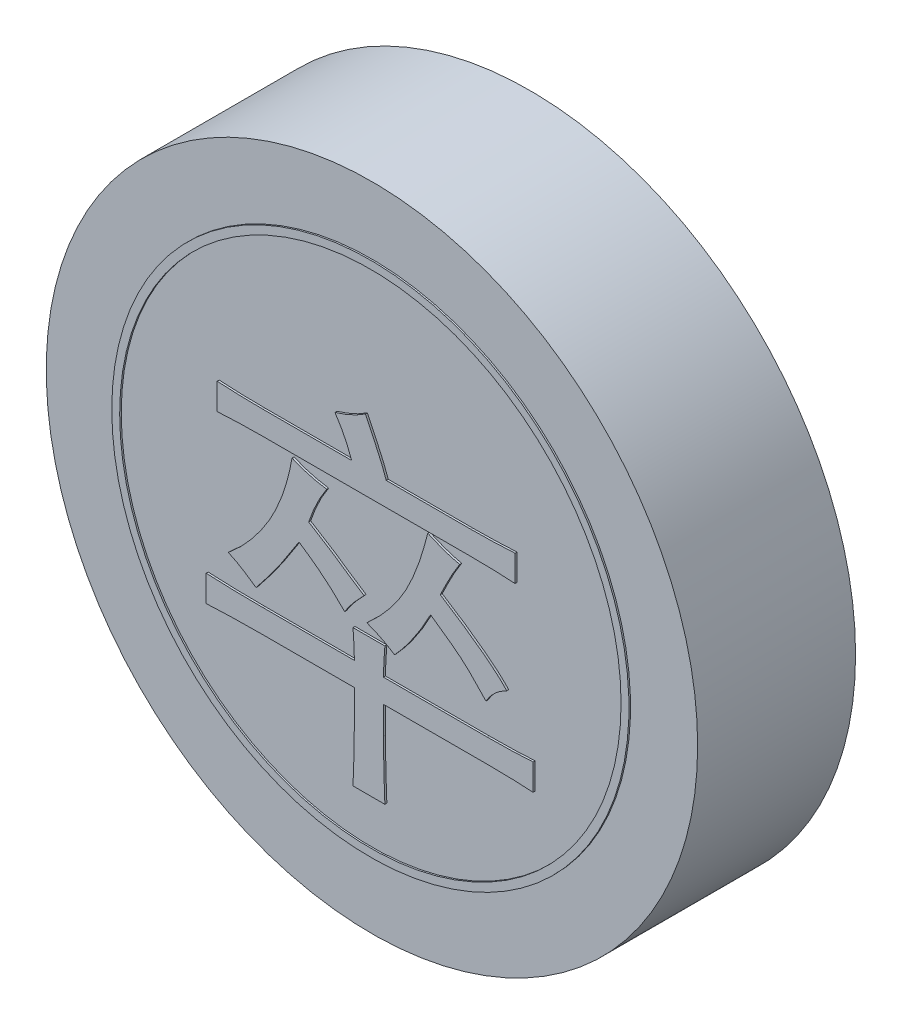
from build123d import *

# Parameters (mm, degrees)
SKETCH_1_R               = 16.5
DIAMETER33_HEIGHT8_DEPTH = 8
CHARACTER_DEPTH          = 0.1
SKETCH_3_R               = 13.1
SKETCH_3_R_2             = 12.7
INK_RING_DEPTH           = 0.08


with BuildPart() as part:
    # 草图1 → Diameter33_Height8 (new body)
    with BuildSketch(Plane.XY):
        Circle(SKETCH_1_R)
    extrude(amount=-DIAMETER33_HEIGHT8_DEPTH)

    # 草图2 → Character_卒 (add)
    with BuildSketch(Plane.XY):
        with BuildLine():
            add(Edge.make_bspline(
                [(-0.789473684, -4.850877193), (-0.790801429, -4.759897806), (-0.793710801, -4.56054267), (-0.807970927, -4.235644823), (-0.827994939, -3.858637974), (-0.848649707, -3.590279221), (-0.859649123, -3.447368421)],
                knots=[0, 0, 0, 0, 0.776803547, 1.702141345, 2.77630666, 4, 4, 4, 4], degree=3))
            Line((-0.859649123, -3.447368421), (0.754385965, -3.447368421))
            add(Edge.make_bspline(
                [(0.754385965, -3.447368421), (0.743322045, -3.581608953), (0.722136363, -3.838658655), (0.702337175, -4.207039208), (0.688146654, -4.540612928), (0.685474648, -4.751233078), (0.684210526, -4.850877193)],
                knots=[0, 0, 0, 0, 1.149871826, 2.201825379, 3.14928596, 4, 4, 4, 4], degree=3))
            Line((0.684210526, -4.850877193), (5.947368421, -4.850877193))
            add(Edge.make_bspline(
                [(5.947368421, -4.850877193), (6.153571591, -4.849759117), (6.557354449, -4.847569722), (7.149120938, -4.833995367), (7.715061172, -4.814883935), (8.082995961, -4.791937596), (8.263157895, -4.780701754)],
                knots=[0, 0, 0, 0, 1.067833177, 2.091009239, 3.065248851, 4, 4, 4, 4], degree=3))
            Line((8.263157895, -4.780701754), (8.263157895, -6.114035088))
            add(Edge.make_bspline(
                [(8.263157895, -6.114035088), (8.084728409, -6.102816563), (7.722852753, -6.080064096), (7.169915527, -6.060827798), (6.599807697, -6.04723991), (6.213350691, -6.044996382), (6.01754386, -6.043859649)],
                knots=[0, 0, 0, 0, 0.954695298, 1.936232608, 2.954347453, 4, 4, 4, 4], degree=3))
            Line((6.01754386, -6.043859649), (0.684210526, -6.043859649))
            Line((0.684210526, -6.043859649), (0.684210526, -7.447368421))
            add(Edge.make_bspline(
                [(0.684210526, -7.447368421), (0.685397037, -7.683891967), (0.687800644, -8.163035928), (0.701667727, -8.890804431), (0.721199551, -9.636859607), (0.743233706, -10.140053014), (0.754385965, -10.394736842)],
                knots=[0, 0, 0, 0, 0.962642255, 1.950098551, 2.962472993, 4, 4, 4, 4], degree=3))
            Line((0.754385965, -10.394736842), (-0.859649123, -10.394736842))
            add(Edge.make_bspline(
                [(-0.859649123, -10.394736842), (-0.848496864, -10.140053014), (-0.826462709, -9.636859607), (-0.806930884, -8.890804431), (-0.793063802, -8.163035928), (-0.790660195, -7.683891967), (-0.789473684, -7.447368421)],
                knots=[0, 0, 0, 0, 1.037527007, 2.049901449, 3.037357745, 4, 4, 4, 4], degree=3))
            Line((-0.789473684, -7.447368421), (-0.789473684, -6.043859649))
            Line((-0.789473684, -6.043859649), (-5.421052632, -6.043859649))
            add(Edge.make_bspline(
                [(-5.421052632, -6.043859649), (-5.682701779, -6.044953947), (-6.191304061, -6.047081081), (-6.932940468, -6.060737801), (-7.630551811, -6.079416677), (-8.08082403, -6.102762271), (-8.298245614, -6.114035088)],
                knots=[0, 0, 0, 0, 1.090812078, 2.120356657, 3.092382303, 4, 4, 4, 4], degree=3))
            Line((-8.298245614, -6.114035088), (-8.298245614, -4.780701754))
            add(Edge.make_bspline(
                [(-8.298245614, -4.780701754), (-8.08082403, -4.791974571), (-7.630551811, -4.815320165), (-6.932940468, -4.833999041), (-6.191304061, -4.847655761), (-5.682701779, -4.849782895), (-5.421052632, -4.850877193)],
                knots=[0, 0, 0, 0, 0.907617697, 1.879643343, 2.909187922, 4, 4, 4, 4], degree=3))
            Line((-5.421052632, -4.850877193), (-0.789473684, -4.850877193))
        make_face()
        with BuildLine():
            add(Edge.make_bspline(
                [(-0.228070175, 6.236842105), (-0.156109894, 6.086120817), (-0.019362397, 5.799702277), (0.174042946, 5.392534756), (0.339217718, 5.027307778), (0.485673111, 4.708835423), (0.607257942, 4.433181617), (0.697833971, 4.199102721), (0.775068508, 4.01240031), (0.809623929, 3.899626563), (0.824561404, 3.850877193)],
                knots=[0, 0, 0, 0, 1.536129931, 2.919137034, 4.145724164, 5.222612619, 6.143346331, 6.915728762, 7.531295706, 8, 8, 8, 8], degree=3))
            Line((0.824561404, 3.850877193), (5.105263158, 3.850877193))
            add(Edge.make_bspline(
                [(5.105263158, 3.850877193), (5.479619966, 3.854131443), (6.228685366, 3.860643001), (6.976696154, 3.900909785), (7.350877193, 3.921052632)],
                knots=[0, 0, 0, 0, 0.999530368, 2, 2, 2, 2], degree=3))
            Line((7.350877193, 3.921052632), (7.350877193, 2.587719298))
            add(Edge.make_bspline(
                [(7.350877193, 2.587719298), (7.172447708, 2.598937823), (6.810572051, 2.62169029), (6.257634825, 2.640926588), (5.687526995, 2.654514476), (5.301069989, 2.656758004), (5.105263158, 2.657894737)],
                knots=[0, 0, 0, 0, 0.954695298, 1.936232608, 2.954347453, 4, 4, 4, 4], degree=3))
            Line((5.105263158, 2.657894737), (-5.421052632, 2.657894737))
            add(Edge.make_bspline(
                [(-5.421052632, 2.657894737), (-5.812739886, 2.65481161), (-6.585197979, 2.648731285), (-7.356594534, 2.607864115), (-7.736842105, 2.587719298)],
                knots=[0, 0, 0, 0, 1.014132048, 2, 2, 2, 2], degree=3))
            Line((-7.736842105, 2.587719298), (-7.736842105, 3.921052632))
            add(Edge.make_bspline(
                [(-7.736842105, 3.921052632), (-7.356594534, 3.900907815), (-6.585197979, 3.860040645), (-5.812739886, 3.85396032), (-5.421052632, 3.850877193)],
                knots=[0, 0, 0, 0, 0.985867952, 2, 2, 2, 2], degree=3))
            Line((-5.421052632, 3.850877193), (-0.929824561, 3.850877193))
            add(Edge.make_bspline(
                [(-0.929824561, 3.850877193), (-0.980684131, 3.992024122), (-1.083871457, 4.278392539), (-1.278672781, 4.700093895), (-1.507170176, 5.121999254), (-1.682656017, 5.395799197), (-1.771929825, 5.535087719)],
                knots=[0, 0, 0, 0, 0.953125153, 1.933764644, 2.948857086, 4, 4, 4, 4], degree=3))
            add(Edge.make_bspline(
                [(-1.771929825, 5.535087719), (-1.62459993, 5.58202295), (-1.338428862, 5.673189138), (-0.936560558, 5.846379126), (-0.563050889, 6.023276607), (-0.337677387, 6.166962504), (-0.228070175, 6.236842105)],
                knots=[0, 0, 0, 0, 1.089780509, 2.116771012, 3.084118242, 4, 4, 4, 4], degree=3))
        make_face()
        with BuildLine():
            add(Edge.make_bspline(
                [(-7.175438596, -3.307017544), (-6.98048316, -3.1382579), (-6.588845128, -2.799243528), (-6.061608465, -2.221053989), (-5.568647742, -1.59964673), (-5.203410344, -1.036895342), (-4.931938508, -0.561218149), (-4.747044901, -0.182556888), (-4.574161763, 0.21271815), (-4.415558738, 0.624148149), (-4.275946384, 1.056025341), (-4.148412897, 1.502931906), (-4.039067969, 1.969000373), (-3.978302297, 2.285996), (-3.947368421, 2.447368421)],
                knots=[0, 0, 0, 0, 1.375491815, 2.763169447, 4.169597174, 5.606384173, 6.339559252, 7.092484169, 7.85468537, 8.642352472, 9.44533771, 10.276970463, 11.122860306, 12, 12, 12, 12], degree=3))
            add(Edge.make_bspline(
                [(-3.947368421, 2.447368421), (-3.814656433, 2.391803417), (-3.54492517, 2.278869996), (-3.118673203, 2.141123125), (-2.665766045, 2.031947853), (-2.352791689, 1.98176463), (-2.192982456, 1.956140351)],
                knots=[0, 0, 0, 0, 0.944361974, 1.919374057, 2.937602298, 4, 4, 4, 4], degree=3))
            add(Edge.make_bspline(
                [(-2.192982456, 1.956140351), (-2.284293234, 1.812685301), (-2.468653393, 1.523043743), (-2.709943098, 1.060656442), (-2.922722695, 0.571568579), (-3.043931186, 0.232814436), (-3.105263158, 0.061403509)],
                knots=[0, 0, 0, 0, 0.967322235, 1.953062777, 2.964241725, 4, 4, 4, 4], degree=3))
            add(Edge.make_bspline(
                [(-3.105263158, 0.061403509), (-3.020228191, 0.010504163), (-2.855762835, -0.087939797), (-2.619989225, -0.233850972), (-2.400530295, -0.369430286), (-2.198029978, -0.495811494), (-2.014389128, -0.615899211), (-1.846910459, -0.724242679), (-1.699279535, -0.826802965), (-1.516932472, -0.950576249), (-1.289766439, -1.115157015), (-0.98850906, -1.312321987), (-0.657510176, -1.535390238), (-0.421660264, -1.684915094), (-0.298245614, -1.763157895)],
                knots=[0, 0, 0, 0, 1.065426832, 2.060632332, 2.980788783, 3.838740189, 4.626696748, 5.339690255, 5.982964193, 6.559079281, 7.708973115, 8.998013454, 10.429131845, 12, 12, 12, 12], degree=3))
            add(Edge.make_bspline(
                [(-0.298245614, -1.763157895), (-0.398983324, -1.866099762), (-0.592943538, -2.064303858), (-0.855906896, -2.367663443), (-1.087553396, -2.659506482), (-1.217997872, -2.859840826), (-1.280701754, -2.956140351)],
                knots=[0, 0, 0, 0, 1.115835912, 2.148428553, 3.109960639, 4, 4, 4, 4], degree=3))
            add(Edge.make_bspline(
                [(-1.280701754, -2.956140351), (-1.392981851, -2.84575781), (-1.607095735, -2.635262495), (-1.916319833, -2.342034468), (-2.201826683, -2.090084909), (-2.555473971, -1.80068924), (-3.014548048, -1.456793306), (-3.396105984, -1.197551304), (-3.596491228, -1.061403509)],
                knots=[0, 0, 0, 0, 0.945286653, 1.802625772, 2.558111326, 3.230756287, 4.54565841, 6, 6, 6, 6], degree=3))
            add(Edge.make_bspline(
                [(-3.596491228, -1.061403509), (-3.677005016, -1.187063521), (-3.834269518, -1.432510416), (-4.066143699, -1.792254053), (-4.289014727, -2.134905351), (-4.512900431, -2.472857319), (-4.756501985, -2.828813939), (-5.048766257, -3.221941743), (-5.389492428, -3.670215688), (-5.639535127, -3.983331586), (-5.771929825, -4.149122807)],
                knots=[0, 0, 0, 0, 0.947604617, 1.85091985, 2.717562405, 3.542964283, 4.424922328, 5.455851291, 6.65290289, 8, 8, 8, 8], degree=3))
            add(Edge.make_bspline(
                [(-5.771929825, -4.149122807), (-5.896852759, -4.06059604), (-6.137481231, -3.890074424), (-6.496341391, -3.660207888), (-6.83908116, -3.466386711), (-7.06651396, -3.358627013), (-7.175438596, -3.307017544)],
                knots=[0, 0, 0, 0, 1.120543842, 2.158408734, 3.118004707, 4, 4, 4, 4], degree=3))
        make_face()
        with BuildLine():
            add(Edge.make_bspline(
                [(4.543859649, 2.026315789), (4.469975902, 1.910021666), (4.309750845, 1.657825028), (4.075909531, 1.234739939), (3.820958713, 0.743415704), (3.651325566, 0.389411189), (3.561403509, 0.201754386)],
                knots=[0, 0, 0, 0, 0.797117921, 1.728638155, 2.795957437, 4, 4, 4, 4], degree=3))
            add(Edge.make_bspline(
                [(3.561403509, 0.201754386), (3.758505993, 0.076814066), (4.138264217, -0.163908999), (4.680262127, -0.52293061), (5.173532329, -0.86614998), (5.620763562, -1.188726592), (6.016907487, -1.496709829), (6.366499894, -1.784851945), (6.669366457, -2.055358757), (6.846736443, -2.23868371), (6.929824561, -2.324561404)],
                knots=[0, 0, 0, 0, 1.327108154, 2.556945121, 3.696800934, 4.744383079, 5.692453866, 6.549752354, 7.320638453, 8, 8, 8, 8], degree=3))
            add(Edge.make_bspline(
                [(6.929824561, -2.324561404), (6.817447827, -2.385098573), (6.597967485, -2.503332287), (6.313249187, -2.738566552), (6.064388321, -3.001005035), (5.93967435, -3.204877821), (5.877192982, -3.307017544)],
                knots=[0, 0, 0, 0, 1.045766307, 2.042461452, 3.019278403, 4, 4, 4, 4], degree=3))
            add(Edge.make_bspline(
                [(5.877192982, -3.307017544), (5.765310551, -3.185014254), (5.552795255, -2.953274876), (5.23937661, -2.634952044), (4.958962948, -2.353416276), (4.728529418, -2.151752811), (4.547327904, -1.996466107), (4.39214823, -1.878488863), (4.220615611, -1.744830294), (4.029887052, -1.599967896), (3.817264655, -1.446541037), (3.586848176, -1.279791215), (3.334895023, -1.104029856), (3.160322937, -0.98336362), (3.070175439, -0.921052632)],
                knots=[0, 0, 0, 0, 1.612216372, 3.062327431, 4.351272069, 5.480958766, 6.043892015, 6.675219284, 7.379081896, 8.162202959, 9.007845852, 9.932916552, 10.93257619, 12, 12, 12, 12], degree=3))
            add(Edge.make_bspline(
                [(3.070175439, -0.921052632), (2.930514441, -1.180277916), (2.659259379, -1.68375542), (2.209696422, -2.385917946), (1.748001726, -3.02305322), (1.409856854, -3.403116152), (1.245614035, -3.587719298)],
                knots=[0, 0, 0, 0, 1.090056543, 2.117150532, 3.085467416, 4, 4, 4, 4], degree=3))
            add(Edge.make_bspline(
                [(1.245614035, -3.587719298), (1.138153716, -3.518750761), (0.922019744, -3.380034964), (0.578909927, -3.19530879), (0.218536354, -3.028855461), (-0.03166829, -2.933879569), (-0.157894737, -2.885964912)],
                knots=[0, 0, 0, 0, 0.973872776, 1.958741545, 2.970199756, 4, 4, 4, 4], degree=3))
            add(Edge.make_bspline(
                [(-0.157894737, -2.885964912), (0.033942517, -2.709635903), (0.410576218, -2.363449509), (0.915487717, -1.801476897), (1.360095455, -1.219507278), (1.684798143, -0.711523457), (1.912476358, -0.282934148), (2.080859113, 0.05825593), (2.236892028, 0.424811579), (2.391534722, 0.81230225), (2.536718133, 1.223418604), (2.673088755, 1.657482031), (2.80708242, 2.113797372), (2.888251647, 2.42720136), (2.929824561, 2.587719298)],
                knots=[0, 0, 0, 0, 1.46582543, 2.877852168, 4.245122148, 5.584316448, 6.264949613, 6.97585841, 7.724954112, 8.506361158, 9.323726205, 10.178041031, 11.066836706, 12, 12, 12, 12], degree=3))
            add(Edge.make_bspline(
                [(2.929824561, 2.587719298), (3.076473605, 2.522091404), (3.359300137, 2.395521813), (3.776621741, 2.237680667), (4.167581497, 2.112262132), (4.422129248, 2.054120441), (4.543859649, 2.026315789)],
                knots=[0, 0, 0, 0, 1.125667068, 2.170955253, 3.125310081, 4, 4, 4, 4], degree=3))
        make_face()
    extrude(amount=CHARACTER_DEPTH)

    # 草图3 → Ink_ring (add)
    with BuildSketch(Plane.XY):
        with Locations(Location((0, 0, 0), (0, 0, 180))):
            Circle(SKETCH_3_R)
        with Locations(Location((0, 0, 0), (0, 0, 180))):
            Circle(SKETCH_3_R_2, mode=Mode.SUBTRACT)
    extrude(amount=INK_RING_DEPTH)


solid = part.part
